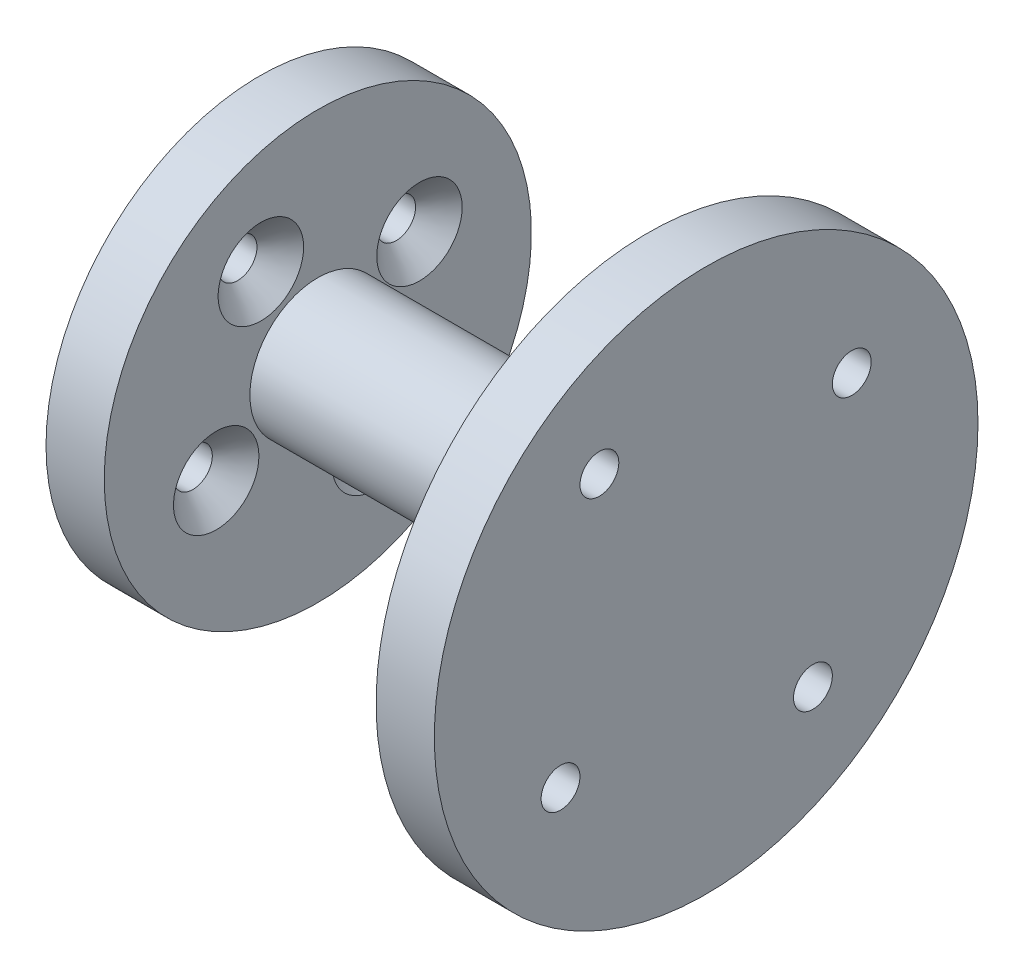
from build123d import *

# Parameters (mm, degrees)
SKETCH_1_W                  = 3
SKETCH_1_H                  = 11
HOLE_WIZARD_M22_D           = 2
HOLE_WIZARD_M22_CSINK_D     = 4.4
HOLE_WIZARD_M22_CSINK_ANGLE = 90
PATTERN_CIRCULAR_2_COUNT    = 4
SKETCH_6_R                  = 3.5
EXTRUDE_1_DEPTH             = 17
SKETCH_7_R                  = 14
EXTRUDE_2_DEPTH             = 3
CUT_EXTRUDE_1_REACH         = 32.348
SKETCH_8_R                  = 1
PATTERN_CIRCULAR_3_COUNT    = 4


with BuildPart() as part:
    # Эскиз1 → Повернуть1 (revolve)
    with BuildSketch(Plane.XY):
        with Locations((5.5, 5.5)):
            Rectangle(SKETCH_1_W, SKETCH_1_H)
    revolve(axis=Axis((0, 0, 0), (1, 0, 0)))

    # Зенковка для  винта с плоской головкой M22 (through all)
    with Locations(Plane(origin=(7, 0, 0), x_dir=(0, 0, -1), z_dir=(1, 0, 0))):
        with Locations((-2.933383142, 5.234048466)):
            hole_wizard_m22 = CounterSinkHole(HOLE_WIZARD_M22_D / 2, HOLE_WIZARD_M22_CSINK_D / 2, counter_sink_angle=HOLE_WIZARD_M22_CSINK_ANGLE)

    # Круговой массив2: Зенковка для  винта с плоской головкой M22 ×4 about axis
    pattern_circular_2_axis = Axis((7, 0, 0), (-1, 0, 0))
    for i in range(1, PATTERN_CIRCULAR_2_COUNT):
        add(hole_wizard_m22.rotate(pattern_circular_2_axis, i * 360 / PATTERN_CIRCULAR_2_COUNT), mode=Mode.SUBTRACT)

    # Эскиз6 → Бобышка-Вытянуть1 (add)
    with BuildSketch(Plane(origin=(7, 0, 0), x_dir=(0, 0, -1), z_dir=(1, 0, 0))):
        Circle(SKETCH_6_R)
    extrude(amount=EXTRUDE_1_DEPTH)

    # Эскиз7 → Бобышка-Вытянуть2 (add)
    with BuildSketch(Plane(origin=(24, 0, 0), x_dir=(0, 0, -1), z_dir=(1, 0, 0))):
        Circle(SKETCH_7_R)
    extrude(amount=EXTRUDE_2_DEPTH)

    # Эскиз8 → Вырез-Вытянуть1 (cut, up to next)
    with BuildSketch(Plane(origin=(27, 0, 0), x_dir=(0, 0, -1), z_dir=(1, 0, 0)), mode=Mode.PRIVATE) as cut_extrude_1_sk1:
        with Locations((-5.499090834, 7.5)):
            Circle(SKETCH_8_R)
    cut_extrude_1_tool1 = extrude(cut_extrude_1_sk1.sketch, amount=-CUT_EXTRUDE_1_REACH, mode=Mode.PRIVATE) & part.part
    cut_extrude_1 = cut_extrude_1_tool1.solids().sort_by_distance((27, 7.5, 5.499091))[0]
    add(cut_extrude_1, mode=Mode.SUBTRACT)

    # Круговой массив3: Вырез-Вытянуть1 ×4 about axis
    pattern_circular_3_axis = Axis((7, 0, 0), (-1, 0, 0))
    for i in range(1, PATTERN_CIRCULAR_3_COUNT):
        add(cut_extrude_1.rotate(pattern_circular_3_axis, i * 360 / PATTERN_CIRCULAR_3_COUNT), mode=Mode.SUBTRACT)


solid = part.part
